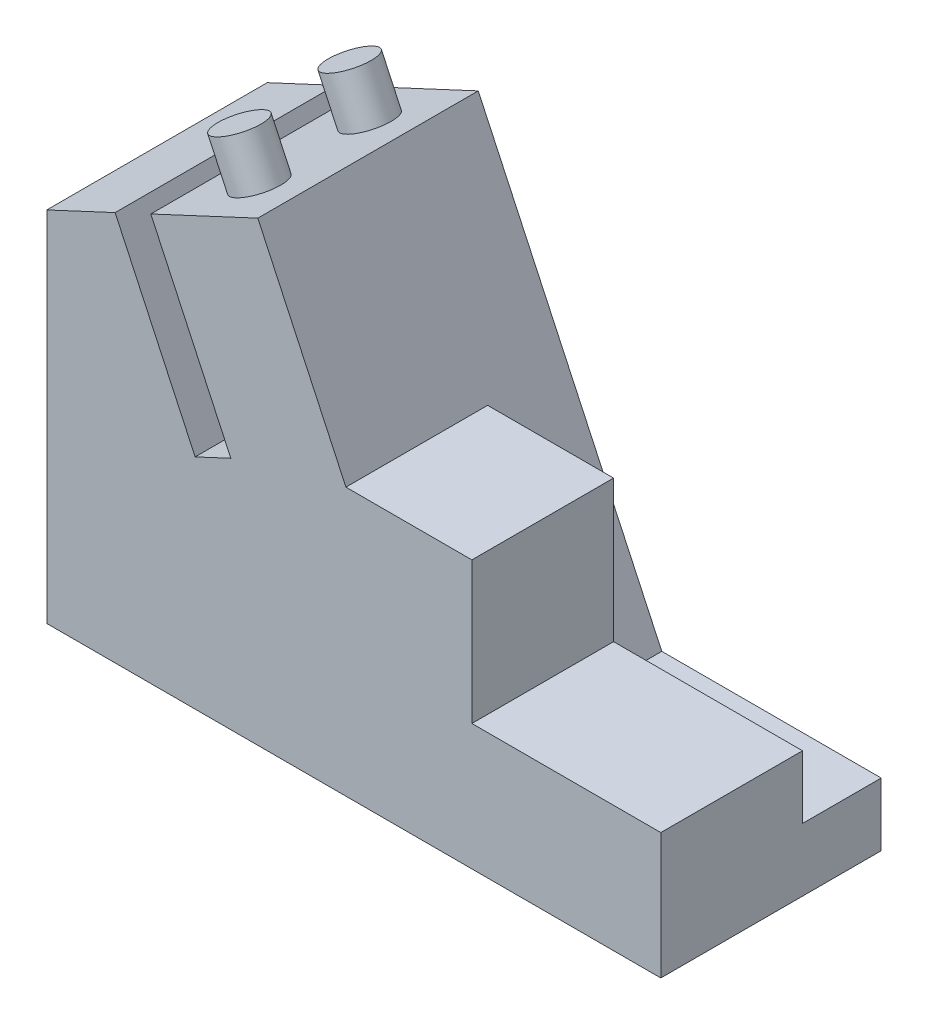
from build123d import *

# Parameters (mm, degrees)
BOSS_EXTRUDE1_DEPTH = 18
BOSS_EXTRUDE2_DEPTH = 28
SKETCH4_R           = 3
BOSS_EXTRUDE3_DEPTH = 6


with BuildPart() as part:
    # Sketch1 → Boss-Extrude1 (new body)
    with BuildSketch(Plane.XY):
        Polygon((-27.876000888, 8), (0, 8), (0, 16), (-24, 16), (-24, 34), (-40, 34), align=None)
    extrude(amount=-BOSS_EXTRUDE1_DEPTH)

    # Sketch1<4> → Boss-Extrude2 (add)
    with BuildSketch(Plane.XY):
        Polygon((-78, 0), (0, 0), (0, 8), (-27.876000888, 8), (-40, 34), (-51.191383796, 58), (-64.786000601, 51.660726074), (-54.622678955, 29.865412469), (-59.154217891, 27.75232116), (-69.317539536, 49.547634765), (-78, 45.498936959), align=None)
    extrude(amount=-BOSS_EXTRUDE2_DEPTH)

    # Sketch4 → Boss-Extrude3 (add)
    with BuildSketch(Plane(origin=(-31.358387135, 67.248278227, 0), x_dir=(0.9063077870366475, 0.42261826174070477, 0), z_dir=(-0.42261826174070477, 0.9063077870366475, 0))):
        with Locations((-29.383290582, 7)):
            Circle(SKETCH4_R)
        with Locations((-29.383290582, 21)):
            Circle(SKETCH4_R)
    extrude(amount=BOSS_EXTRUDE3_DEPTH)


solid = part.part
